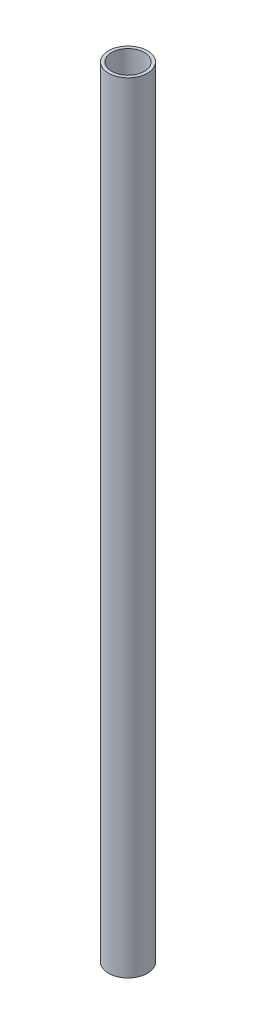
from build123d import *

# Parameters (mm, degrees)
SKETCH1_R           = 12.5
SKETCH1_R_2         = 10.5
BOSS_EXTRUDE1_DEPTH = 500


with BuildPart() as part:
    # Sketch1 → Boss-Extrude1 (new body)
    with BuildSketch(Plane(origin=(0, 0, 0), x_dir=(1, 0, 0), z_dir=(0, 1, 0))):
        with Locations(Location((0, 0, 0), (0, 0, 270))):
            Circle(SKETCH1_R)
        with Locations(Location((0, 0, 0), (0, 0, 270))):
            Circle(SKETCH1_R_2, mode=Mode.SUBTRACT)
    extrude(amount=BOSS_EXTRUDE1_DEPTH)


solid = part.part
